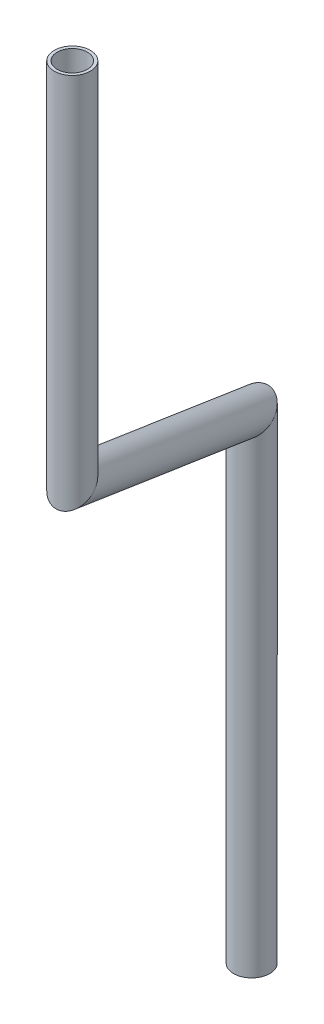
from build123d import *

# Parameters (mm, degrees)
SKETCH1_R                 = 6.35
SKETCH1_R_2               = 5.2832
PIPE_0_5_SCH_40_1_DEPTH   = 135.868226331
SKETCH1_ON_SEGMENT_2_R    = 6.35
SKETCH1_ON_SEGMENT_2_R_2  = 5.2832
PIPE_0_5_SCH_40_1_2_DEPTH = 106.737796737
SKETCH1_ON_SEGMENT_3_R    = 6.35
SKETCH1_ON_SEGMENT_3_R_2  = 5.2832
PIPE_0_5_SCH_40_1_3_DEPTH = 175.461544754


with BuildPart() as part:
    # Sketch1 → Pipe 0.5 SCH 40(1) (new body)
    with BuildSketch(Plane(origin=(-803.872074604, -70.16751082, 358.35050715), x_dir=(1, 0, 0), z_dir=(0, -1, 0))):
        Circle(SKETCH1_R)
        Circle(SKETCH1_R_2, mode=Mode.SUBTRACT)
    extrude(amount=PIPE_0_5_SCH_40_1_DEPTH)

    # Pipe 0.5 SCH 40(1) mitre 1
    split(bisect_by=Plane(origin=(-803.872074604, -198.688949127, 358.35050715), x_dir=(-0.985559743, 0.169328061, 0), z_dir=(0.140305136, 0.816634249, 0.559841918)), keep=Keep.TOP)


with BuildPart() as body_2:
    # Sketch1 on segment 2 (carried to segment 2) → Pipe 0.5 SCH 40_1 2 (new body)
    with BuildSketch(Plane(origin=(-802.188514347, -196.236716241, 365.06820564), x_dir=(0.960628937, -0.229155959, -0.157097393), z_dir=(-0.229155959, -0.333782992, -0.914372168))):
        Circle(SKETCH1_ON_SEGMENT_2_R)
        Circle(SKETCH1_ON_SEGMENT_2_R_2, mode=Mode.SUBTRACT)
    extrude(amount=PIPE_0_5_SCH_40_1_2_DEPTH)

    # Pipe 0.5 SCH 40_1 2 mitre 1
    split(bisect_by=Plane(origin=(-803.872074604, -198.688949127, 358.35050715), x_dir=(0.985559743, -0.169328061, 0), z_dir=(-0.140305136, -0.816634249, -0.559841918)), keep=Keep.TOP)

    # Pipe 0.5 SCH 40_1 2 mitre 2
    split(bisect_by=Plane(origin=(-824.964556297, -229.411744477, 274.187833569), x_dir=(-0.985559743, 0.169328061, 0), z_dir=(0.140305136, 0.816634249, 0.559841918)), keep=Keep.TOP)


with BuildPart() as body_3:
    # Sketch1 on segment 3 (carried to segment 3) → Pipe 0.5 SCH 40_1 3 (new body)
    with BuildSketch(Plane(origin=(-824.964556297, -222.064956453, 274.187833569), x_dir=(1, 0, 0), z_dir=(0, -1, 0))):
        Circle(SKETCH1_ON_SEGMENT_3_R)
        Circle(SKETCH1_ON_SEGMENT_3_R_2, mode=Mode.SUBTRACT)
    extrude(amount=PIPE_0_5_SCH_40_1_3_DEPTH)

    # Pipe 0.5 SCH 40_1 3 mitre 1
    split(bisect_by=Plane(origin=(-824.964556297, -229.411744477, 274.187833569), x_dir=(0.985559743, -0.169328061, 0), z_dir=(-0.140305136, -0.816634249, -0.559841918)), keep=Keep.TOP)


solid = Compound([part.part, body_2.part, body_3.part])
